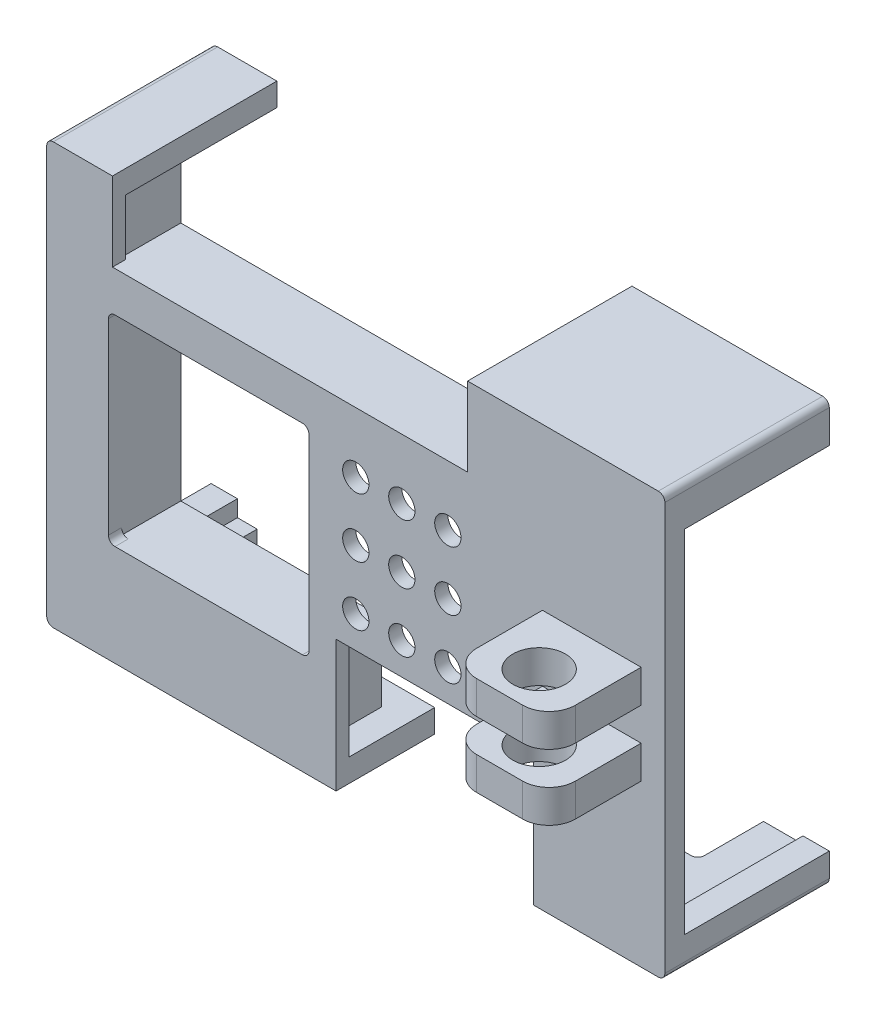
from build123d import *

# Parameters (mm, degrees)
SKETCH_1_W           = 94
SKETCH_1_H           = 64
EXTRUDE_1_DEPTH      = 25
SKETCH_3_W           = 86
SKETCH_3_H           = 57
CUT_EXTRUDE_1_DEPTH  = 23
FILLET_1_R           = 1
SKETCH_4_W           = 77
SKETCH_4_H           = 10
CUT_EXTRUDE_3_DEPTH  = 5
FILLET_4_R           = 1
SKETCH_5_W           = 54
SKETCH_5_H           = 25
CUT_EXTRUDE_4_DEPTH  = 12
SKETCH_6_W           = 30
SKETCH_6_H           = 20
CUT_EXTRUDE_5_DEPTH  = 18
SKETCH_7_W           = 22
SKETCH_7_H           = 52
CUT_EXTRUDE_6_DEPTH  = 5
SKETCH_8_W           = 30.5
SKETCH_8_H           = 30.5
CUT_EXTRUDE_7_DEPTH  = 5
FILLET_5_R           = 1
SKETCH_9_R           = 1.55
CUT_EXTRUDE_8_DEPTH  = 5
SKETCH_10_W          = 4
SKETCH_10_H          = 53.4
CUT_EXTRUDE_9_DEPTH  = 22
SKETCH_11_W          = 30.5
SKETCH_11_H          = 11.890365251
EXTRUDE_2_DEPTH      = 9
SKETCH_12_W          = 54.61329803
SKETCH_12_H          = 6.109634749
SKETCH_12_W_2        = 5.38670197
SKETCH_12_H_2        = 57
SKETCH_12_W_3        = 8
SKETCH_12_H_3        = 27
EXTRUDE_3_DEPTH      = 9
SKETCH_13_R          = 2
CUT_EXTRUDE_10_DEPTH = 10
SKETCH_14_W          = 15
SKETCH_14_H          = 15
EXTRUDE_4_DEPTH      = 14
SKETCH_17_R          = 4
CUT_EXTRUDE_13_DEPTH = 67.289139382
FILLET_7_R           = 4
SKETCH_18_W          = 15
SKETCH_18_H          = 5
CUT_EXTRUDE_14_DEPTH = 63.112800613


with BuildPart() as part:
    # 草图1 → 凸台-拉伸1 (new body)
    with BuildSketch(Plane.XY):
        Rectangle(SKETCH_1_W, SKETCH_1_H)
    extrude(amount=-EXTRUDE_1_DEPTH)

    # 草图3 → 切除-拉伸1 (cut)
    with BuildSketch(Plane(origin=(0, 0, -25), x_dir=(-1, 0, 0), z_dir=(0, 0, -1))):
        Rectangle(SKETCH_3_W, SKETCH_3_H)
    extrude(amount=-CUT_EXTRUDE_1_DEPTH, mode=Mode.SUBTRACT)

    # 圆角1
    fillet_1_edges = [part.edges().sort_by_distance(p)[0] for p in [
        (47, -32, -12.5),
        (-47, -32, -12.5),
        (-47, 32, -12.5),
        (47, 32, -12.5),
    ]]
    fillet(fillet_1_edges, radius=FILLET_1_R)

    # 草图4 → 切除-拉伸3 (cut)
    with BuildSketch(Plane.XZ.offset(32)):
        with Locations((-1.5, -20)):
            Rectangle(SKETCH_4_W, SKETCH_4_H)
    extrude(amount=-CUT_EXTRUDE_3_DEPTH, mode=Mode.SUBTRACT)

    # 圆角4
    fillet_4_edges = [part.edges().sort_by_distance(p)[0] for p in [
        (37, -30.25, -15),
        (-40, -30.25, -15),
    ]]
    fillet(fillet_4_edges, radius=FILLET_4_R)

    # 草图5 → 切除-拉伸4 (cut)
    with BuildSketch(Plane(origin=(0, 32, 0), x_dir=(1, 0, 0), z_dir=(0, 1, 0))):
        with Locations((-10, 12.5)):
            Rectangle(SKETCH_5_W, SKETCH_5_H)
    extrude(amount=-CUT_EXTRUDE_4_DEPTH, mode=Mode.SUBTRACT)

    # 草图6 → 切除-拉伸5 (cut)
    with BuildSketch(Plane.XY):
        with Locations((12, -22)):
            Rectangle(SKETCH_6_W, SKETCH_6_H)
    extrude(amount=-CUT_EXTRUDE_5_DEPTH, mode=Mode.SUBTRACT)

    # 草图7 → 切除-拉伸6 (cut)
    with BuildSketch(Plane.ZY.offset(47)):
        with Locations((-14, 0)):
            Rectangle(SKETCH_7_W, SKETCH_7_H)
    extrude(amount=-CUT_EXTRUDE_6_DEPTH, mode=Mode.SUBTRACT)

    # 草图8 → 切除-拉伸7 (cut)
    with BuildSketch(Plane.XY):
        with Locations((-22.36329803, -1.359634749)):
            Rectangle(SKETCH_8_W, SKETCH_8_H)
    extrude(amount=-CUT_EXTRUDE_7_DEPTH, mode=Mode.SUBTRACT)

    # 圆角5
    fillet_5_edges = [part.edges().sort_by_distance(p)[0] for p in [
        (-7.11329803, 13.890365251, -1),
        (-7.11329803, -16.609634749, -1),
        (-37.61329803, -16.609634749, -1),
        (-37.61329803, 13.890365251, -1),
    ]]
    fillet(fillet_5_edges, radius=FILLET_5_R)

    # 草图9 → 切除-拉伸8 (cut)
    with BuildSketch(Plane(origin=(0, 0, -25), x_dir=(-1, 0, 0), z_dir=(0, 0, -1))):
        with Locations((44.7, 29.7)):
            Circle(SKETCH_9_R)
        with Locations(Location((44.7, -29.7, 0), (0, 0, 180))):
            Circle(SKETCH_9_R)
        with Locations((-44.7, -29.7)):
            Circle(SKETCH_9_R)
        with Locations(Location((-44.7, 29.7, 0), (0, 0, 180))):
            Circle(SKETCH_9_R)
    extrude(amount=-CUT_EXTRUDE_8_DEPTH, mode=Mode.SUBTRACT)

    # 草图10 → 切除-拉伸9 (cut)
    with BuildSketch(Plane(origin=(0, 0, -25), x_dir=(-1, 0, 0), z_dir=(0, 0, -1))):
        with Locations((-45, -0.7)):
            Rectangle(SKETCH_10_W, SKETCH_10_H)
    extrude(amount=-CUT_EXTRUDE_9_DEPTH, mode=Mode.SUBTRACT)

    # 草图11 → 凸台-拉伸2 (add)
    with BuildSketch(Plane(origin=(0, 0, -2), x_dir=(-1, 0, 0), z_dir=(0, 0, -1))):
        with Locations((22.36329803, -22.554817375)):
            Rectangle(SKETCH_11_W, SKETCH_11_H)
    extrude(amount=EXTRUDE_2_DEPTH)

    # 草图12 → 凸台-拉伸3 (add)
    with BuildSketch(Plane(origin=(0, 0, -2), x_dir=(-1, 0, 0), z_dir=(0, 0, -1))):
        with Locations((10.306649015, 16.945182625)):
            Rectangle(SKETCH_12_W, SKETCH_12_H)
        with Locations((40.306649015, 0)):
            Rectangle(SKETCH_12_W_2, SKETCH_12_H_2)
        with Locations((-21, 15)):
            Rectangle(SKETCH_12_W_3, SKETCH_12_H_3)
    extrude(amount=EXTRUDE_3_DEPTH)

    # 草图13 → 切除-拉伸10 (cut)
    with BuildSketch(Plane.XY):
        with Locations((0, 10.839030868)):
            Circle(SKETCH_13_R)
        with Locations((7, 10.839030868)):
            Circle(SKETCH_13_R)
        with Locations((14, 10.839030868)):
            Circle(SKETCH_13_R)
        with Locations((7, 1.839030868)):
            Circle(SKETCH_13_R)
        with Locations((14, 1.839030868)):
            Circle(SKETCH_13_R)
        with Locations((7, -7.160969132)):
            Circle(SKETCH_13_R)
        with Locations((14, -7.160969132)):
            Circle(SKETCH_13_R)
        with Locations((0, 1.839030868)):
            Circle(SKETCH_13_R)
        with Locations((0, -7.160969132)):
            Circle(SKETCH_13_R)
    extrude(amount=-CUT_EXTRUDE_10_DEPTH, mode=Mode.SUBTRACT)

    # 草图14 → 凸台-拉伸4 (add)
    with BuildSketch(Plane.XY):
        with Locations((35.885750834, 0)):
            Rectangle(SKETCH_14_W, SKETCH_14_H)
    extrude(amount=EXTRUDE_4_DEPTH)

    # 草图17 → 切除-拉伸13 (cut, through all)
    with BuildSketch(Plane.XZ.offset(7.5)):
        with Locations(Location((35.885750834, 8, 0), (0, 0, 270))):
            Circle(SKETCH_17_R)
    extrude(amount=-CUT_EXTRUDE_13_DEPTH, mode=Mode.SUBTRACT)

    # 圆角7
    fillet_7_edges = [part.edges().sort_by_distance(p)[0] for p in [
        (43.385750834, 0, 14),
        (28.385750834, 0, 14),
    ]]
    fillet(fillet_7_edges, radius=FILLET_7_R)

    # 草图18 → 切除-拉伸14 (cut, through all)
    with BuildSketch(Plane.XY):
        with Locations((35.885750834, 0)):
            Rectangle(SKETCH_18_W, SKETCH_18_H)
    extrude(amount=CUT_EXTRUDE_14_DEPTH, mode=Mode.SUBTRACT)


solid = part.part
